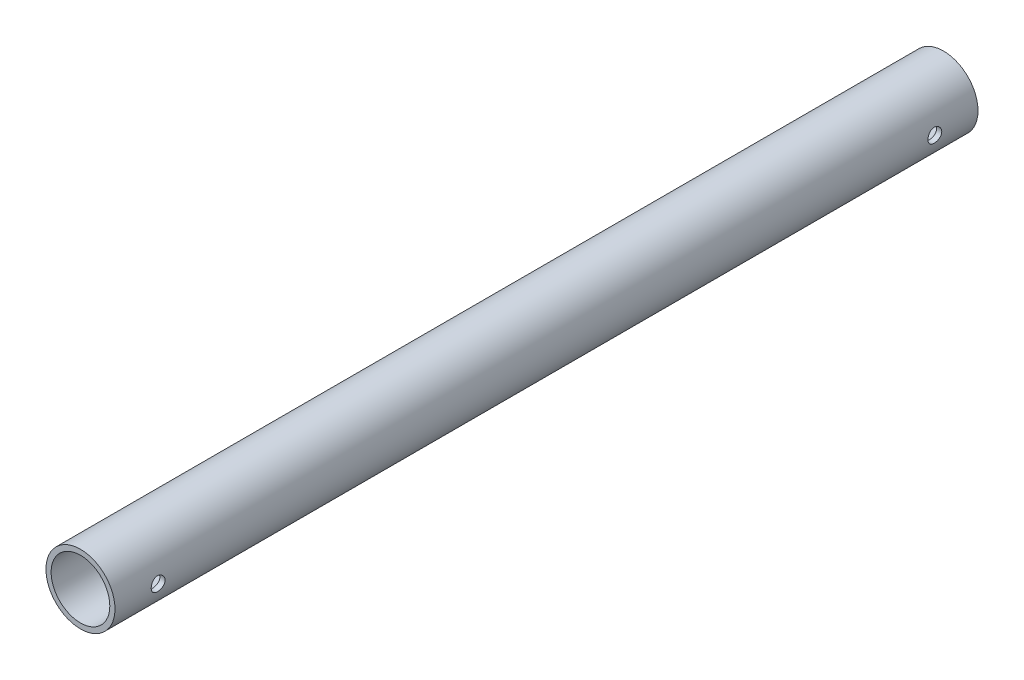
from build123d import *

# Parameters (mm, degrees)
SKETCH1_R           = 10
SKETCH1_R_2         = 8.5
BOSS_EXTRUDE1_DEPTH = 125
SKETCH2_R           = 2
CUT_EXTRUDE1_DEPTH  = 126.797456254


with BuildPart() as part:
    # Sketch1 → Boss-Extrude1 (new body)
    with BuildSketch(Plane.XY):
        Circle(SKETCH1_R)
        Circle(SKETCH1_R_2, mode=Mode.SUBTRACT)
    boss_extrude1 = extrude(amount=BOSS_EXTRUDE1_DEPTH)

    # Sketch2 → Cut-Extrude1 (cut, symmetric)
    with BuildSketch(Plane(origin=(0, 0, 0), x_dir=(0, 0, -1), z_dir=(1, 0, 0))):
        with Locations((-112.5, 0)):
            Circle(SKETCH2_R)
        with Locations((-227.5, 0)):
            Circle(SKETCH2_R)
    cut_extrude1 = extrude(amount=CUT_EXTRUDE1_DEPTH, both=True, mode=Mode.SUBTRACT)

    # Mirror1: Boss-Extrude1, Cut-Extrude1 across plane
    add(boss_extrude1.mirror(Plane.XY))
    add(cut_extrude1.mirror(Plane.XY), mode=Mode.SUBTRACT)


solid = part.part
